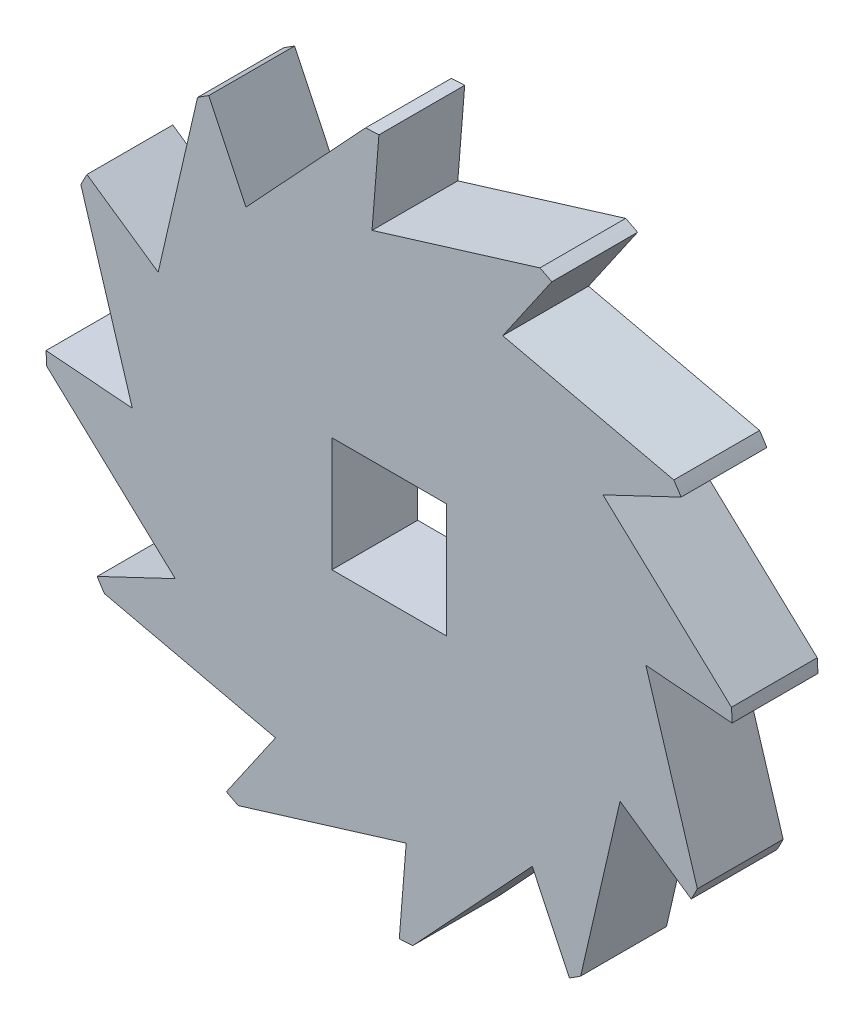
from build123d import *

# Parameters (mm, degrees)
SKETCH1_W           = 10
SKETCH1_H           = 10
BOSS_EXTRUDE1_DEPTH = 7.5


with BuildPart() as part:
    # Sketch1 → Boss-Extrude1 (new body)
    with BuildSketch(Plane.XY):
        with BuildLine():
            Line((9.931375967, 20.189144499), (24.890876528, 16.746470245))
            ThreePointArc((24.890876528, 16.746470245), (25.212386049, 16.25840059), (25.524326618, 15.764160323))
            Line((25.524326618, 15.764160323), (18.695396131, 12.518624033))
            Line((18.695396131, 12.518624033), (29.929366518, 2.057430392))
            ThreePointArc((29.929366518, 2.057430392), (29.963767103, 1.473994911), (29.986795427, 0.89))
            Line((29.986795427, 0.89), (22.45, 1.493748368))
            Line((22.45, 1.493748368), (26.94830692, -13.182896273))
            ThreePointArc((26.94830692, -13.182896273), (26.68638096, -13.705366513), (26.414326618, -14.222635104))
            Line((26.414326618, -14.222635104), (20.189144499, -9.931375967))
            Line((20.189144499, -9.931375967), (16.746470245, -24.890876528))
            ThreePointArc((16.746470245, -24.890876528), (16.25840059, -25.212386049), (15.764160323, -25.524326618))
            Line((15.764160323, -25.524326618), (12.518624033, -18.695396131))
            Line((12.518624033, -18.695396131), (2.057430392, -29.929366518))
            ThreePointArc((2.057430392, -29.929366518), (1.473994911, -29.963767103), (0.89, -29.986795427))
            Line((0.89, -29.986795427), (1.493748368, -22.45))
            Line((1.493748368, -22.45), (-13.182896273, -26.94830692))
            ThreePointArc((-13.182896273, -26.94830692), (-13.705366513, -26.68638096), (-14.222635104, -26.414326618))
            Line((-14.222635104, -26.414326618), (-9.931375967, -20.189144499))
            Line((-9.931375967, -20.189144499), (-24.890876528, -16.746470245))
            ThreePointArc((-24.890876528, -16.746470245), (-25.212386049, -16.25840059), (-25.524326618, -15.764160323))
            Line((-25.524326618, -15.764160323), (-18.695396131, -12.518624033))
            Line((-18.695396131, -12.518624033), (-29.929366518, -2.057430392))
            ThreePointArc((-29.929366518, -2.057430392), (-29.963767103, -1.473994911), (-29.986795427, -0.89))
            Line((-29.986795427, -0.89), (-22.45, -1.493748368))
            Line((-22.45, -1.493748368), (-26.94830692, 13.182896273))
            ThreePointArc((-26.94830692, 13.182896273), (-26.68638096, 13.705366513), (-26.414326618, 14.222635104))
            Line((-26.414326618, 14.222635104), (-20.189144499, 9.931375967))
            Line((-20.189144499, 9.931375967), (-16.746470245, 24.890876528))
            ThreePointArc((-16.746470245, 24.890876528), (-16.25840059, 25.212386049), (-15.764160323, 25.524326618))
            Line((-15.764160323, 25.524326618), (-12.518624033, 18.695396131))
            Line((-12.518624033, 18.695396131), (-2.057430392, 29.929366518))
            ThreePointArc((-2.057430392, 29.929366518), (-1.473994911, 29.963767103), (-0.89, 29.986795427))
            Line((-0.89, 29.986795427), (-1.493748368, 22.45))
            Line((-1.493748368, 22.45), (13.182896273, 26.94830692))
            ThreePointArc((13.182896273, 26.94830692), (13.705366513, 26.68638096), (14.222635104, 26.414326618))
            Line((14.222635104, 26.414326618), (9.931375967, 20.189144499))
        make_face()
        Rectangle(SKETCH1_W, SKETCH1_H, mode=Mode.SUBTRACT)
    extrude(amount=BOSS_EXTRUDE1_DEPTH)


solid = part.part
